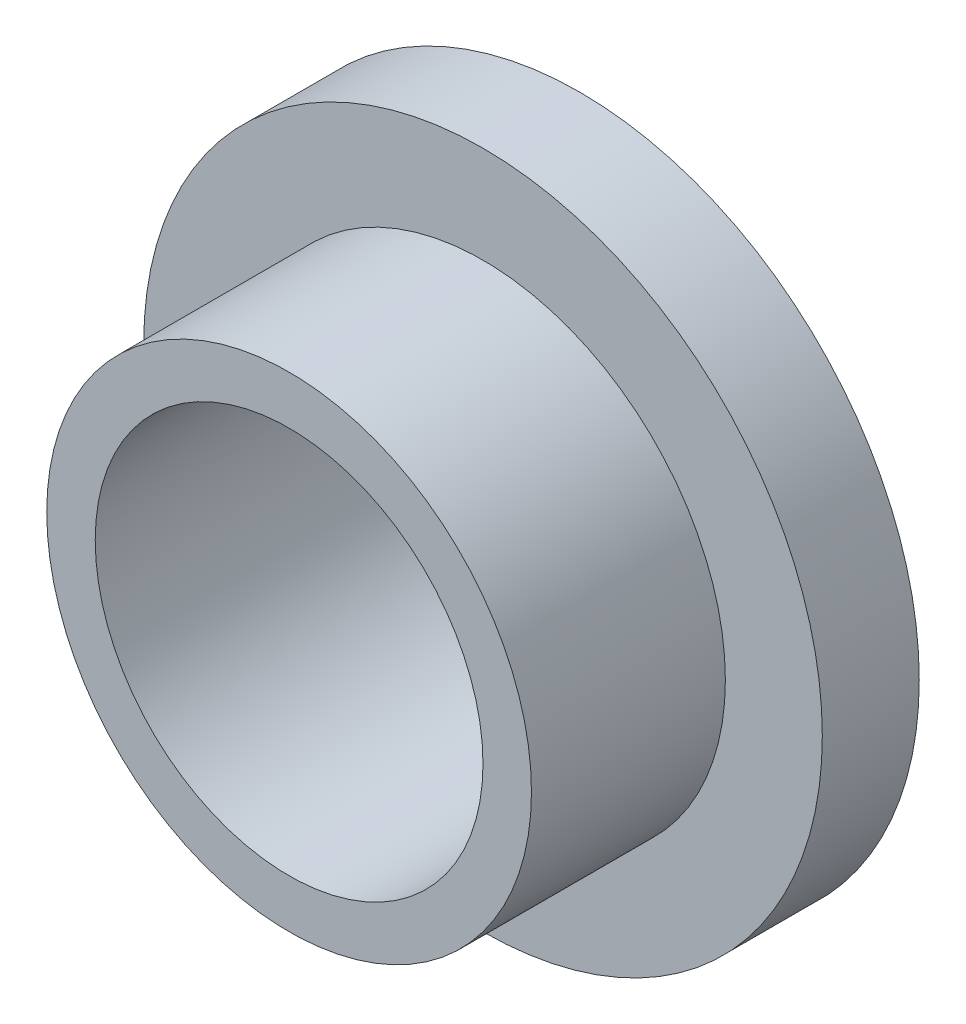
from build123d import *

# Parameters (mm, degrees)
BASE_W   = 9.525
BASE_H   = 1.5875
FLANGE_W = 3.175
FLANGE_H = 3.175


with BuildPart() as part:
    # base → RevolveBase (revolve)
    with BuildSketch(Plane(origin=(0, 0, 0), x_dir=(0, 0, -1), z_dir=(1, 0, 0)), mode=Mode.PRIVATE) as revolvebase_sk:
        with Locations((0, 7.14375)):
            Rectangle(BASE_W, BASE_H)
    revolve(revolvebase_sk.sketch.rotate(Axis((0, 0, 5.88050706), (0, 0, -1)), 90), axis=Axis((0, 0, 5.88050706), (0, 0, -1)))

    # flange → RevolveFlange (revolve)
    with BuildSketch(Plane(origin=(0, 0, 0), x_dir=(0, 0, -1), z_dir=(1, 0, 0)), mode=Mode.PRIVATE) as revolveflange_sk:
        with Locations((3.175, 9.525)):
            Rectangle(FLANGE_W, FLANGE_H)
    revolve(revolveflange_sk.sketch.rotate(Axis((0, 0, 11.055023073), (0, 0, -1)), 90), axis=Axis((0, 0, 11.055023073), (0, 0, -1)))


solid = part.part
